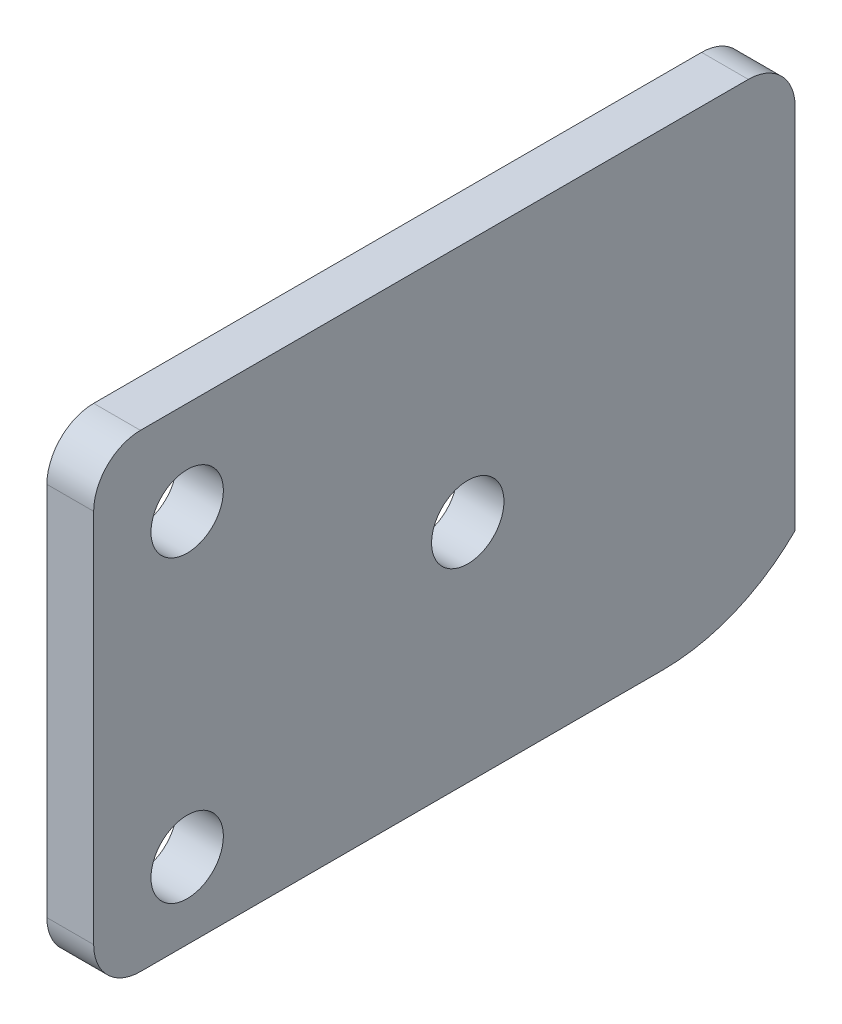
from build123d import *

# Parameters (mm, degrees)
BOSS_EXTRUDE1_DEPTH              = 3.175
F_10_0_1935_DIAMETER_HOLE1_D     = 4.9149
F_10_0_1935_DIAMETER_HOLE1_DEPTH = 9.699415072
F_10_0_1935_DIAMETER_HOLE1_TIP   = 1.476584928
FILLET1_R                        = 3.175


with BuildPart() as part:
    # Sketch1 → Boss-Extrude1 (new body)
    with BuildSketch(Plane(origin=(0, 0, 0), x_dir=(0, 0, -1), z_dir=(1, 0, 0))):
        with BuildLine():
            Line((-25.4, 11.1125), (22.225, 11.1125))
            Line((22.225, 11.1125), (22.225, -17.010023672))
            ThreePointArc((22.225, -17.010023672), (21.479421476, -17.696337769), (20.681497174, -18.321022636))
            ThreePointArc((20.681497174, -18.321022636), (20.108002708, -18.71085711), (19.51408533, -19.068808178))
            ThreePointArc((19.51408533, -19.068808178), (16.492659011, -20.297805158), (13.257849362, -20.716681165))
            Line((13.257849362, -20.716681165), (-25.4, -20.716681165))
            Line((-25.4, -20.716681165), (-25.4, 11.1125))
        make_face()
    extrude(amount=BOSS_EXTRUDE1_DEPTH)

    # #10 (0.1935) Diameter Hole1
    with Locations(Plane.ZY):
        with Locations((19.05, 4.7625), (19.05, -15.5575), (0, -5.3975)):
            Hole(F_10_0_1935_DIAMETER_HOLE1_D / 2, depth=F_10_0_1935_DIAMETER_HOLE1_DEPTH)
            with Locations((0, 0, -(F_10_0_1935_DIAMETER_HOLE1_DEPTH + F_10_0_1935_DIAMETER_HOLE1_TIP / 2))):  # 118° drill point
                Cone(0, F_10_0_1935_DIAMETER_HOLE1_D / 2, F_10_0_1935_DIAMETER_HOLE1_TIP, mode=Mode.SUBTRACT)

    # Fillet1
    fillet1_edges = [part.edges().sort_by_distance(p)[0] for p in [
        (1.5875, 11.1125, 25.4),
        (1.5875, 11.1125, -22.225),
        (1.5875, -20.716681165, 25.4),
    ]]
    fillet(fillet1_edges, radius=FILLET1_R)


solid = part.part
